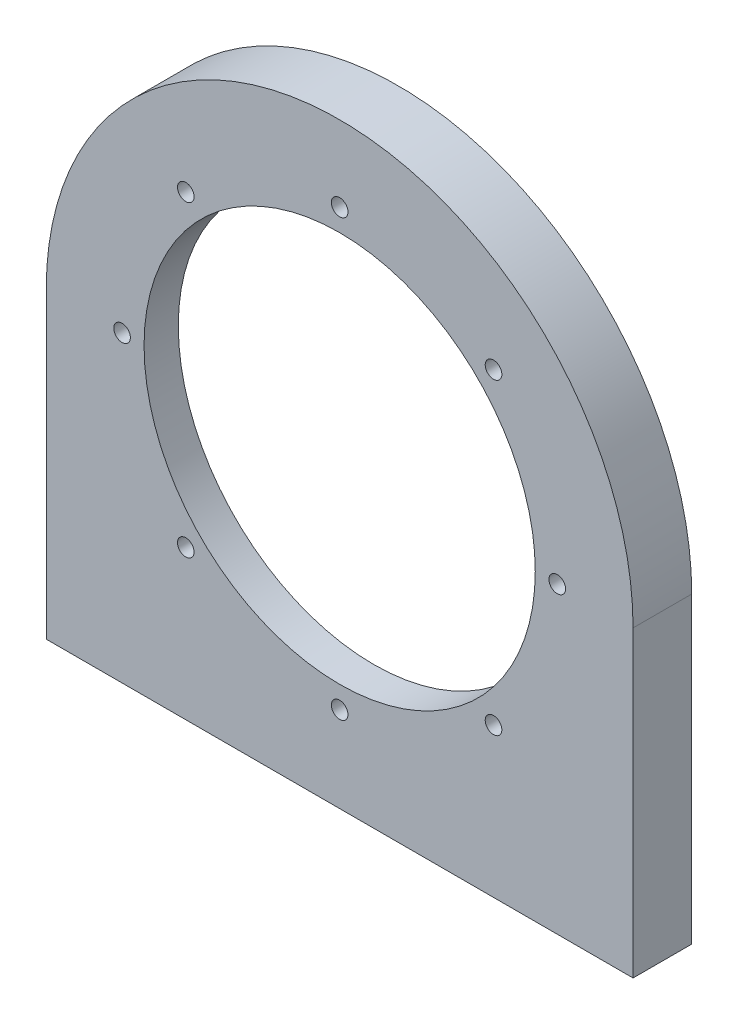
from build123d import *

# Parameters (mm, degrees)
SKETCH1_R                   = 60
SKETCH1_R_2                 = 40
BOSS_EXTRUDE1_DEPTH         = 7
M3_CLEARANCE_HOLE1_D        = 3.4
BOSS_EXTRUDE3_START         = 5
SKETCH4_R                   = 60
SKETCH4_R_2                 = 50
BOSS_EXTRUDE3_DEPTH         = 5
BOSS_EXTRUDE4_START         = -12
BOSS_EXTRUDE4_DEPTH         = 12
TAP_DRILL_FOR_M4_TAP1_D     = 3.3
TAP_DRILL_FOR_M4_TAP1_DEPTH = 10
TAP_DRILL_FOR_M4_TAP1_TIP   = 0.991420021


with BuildPart() as part:
    # Sketch1 → Boss-Extrude1 (new body)
    with BuildSketch(Plane.XY):
        Circle(SKETCH1_R)
        Circle(SKETCH1_R_2, mode=Mode.SUBTRACT)
    extrude(amount=BOSS_EXTRUDE1_DEPTH)

    # M3 Clearance Hole1 (through all)
    with Locations(Plane.XY.offset(7)):
        with Locations((-31.466251763, 31.466251763), (0, 44.5), (31.466251763, 31.466251763), (44.5, 0), (31.466251763, -31.466251763), (0, -44.5), (-31.466251763, -31.466251763), (-44.5, 0)):
            Hole(M3_CLEARANCE_HOLE1_D / 2)

    # Sketch4 → Boss-Extrude3 (add)
    with BuildSketch(Plane(origin=(0, 0, 0), x_dir=(-1, 0, 0), z_dir=(0, 0, -1)).offset(BOSS_EXTRUDE3_START)):
        Circle(SKETCH4_R)
        Circle(SKETCH4_R_2, mode=Mode.SUBTRACT)
    extrude(amount=-BOSS_EXTRUDE3_DEPTH)

    # Sketch5 → Boss-Extrude4 (add)
    with BuildSketch(Plane.XY.offset(7).offset(BOSS_EXTRUDE4_START)):
        with BuildLine():
            Line((-60, 0), (-60, -62))
            Line((-60, -62), (60, -62))
            Line((60, -62), (60, 0))
            ThreePointArc((60, 0), (0, -60), (-60, 0))
        make_face()
    extrude(amount=BOSS_EXTRUDE4_DEPTH)

    # Tap Drill for M4 Tap1
    with Locations(Plane(origin=(0, -62, 0), x_dir=(-1, 0, 0), z_dir=(0, -1, 0))):
        with Locations((-50, -1), (0, -1), (25, -1), (50, -1), (-25, -1)):
            Hole(TAP_DRILL_FOR_M4_TAP1_D / 2, depth=TAP_DRILL_FOR_M4_TAP1_DEPTH)
            with Locations((0, 0, -(TAP_DRILL_FOR_M4_TAP1_DEPTH + TAP_DRILL_FOR_M4_TAP1_TIP / 2))):  # 118° drill point
                Cone(0, TAP_DRILL_FOR_M4_TAP1_D / 2, TAP_DRILL_FOR_M4_TAP1_TIP, mode=Mode.SUBTRACT)


solid = part.part
